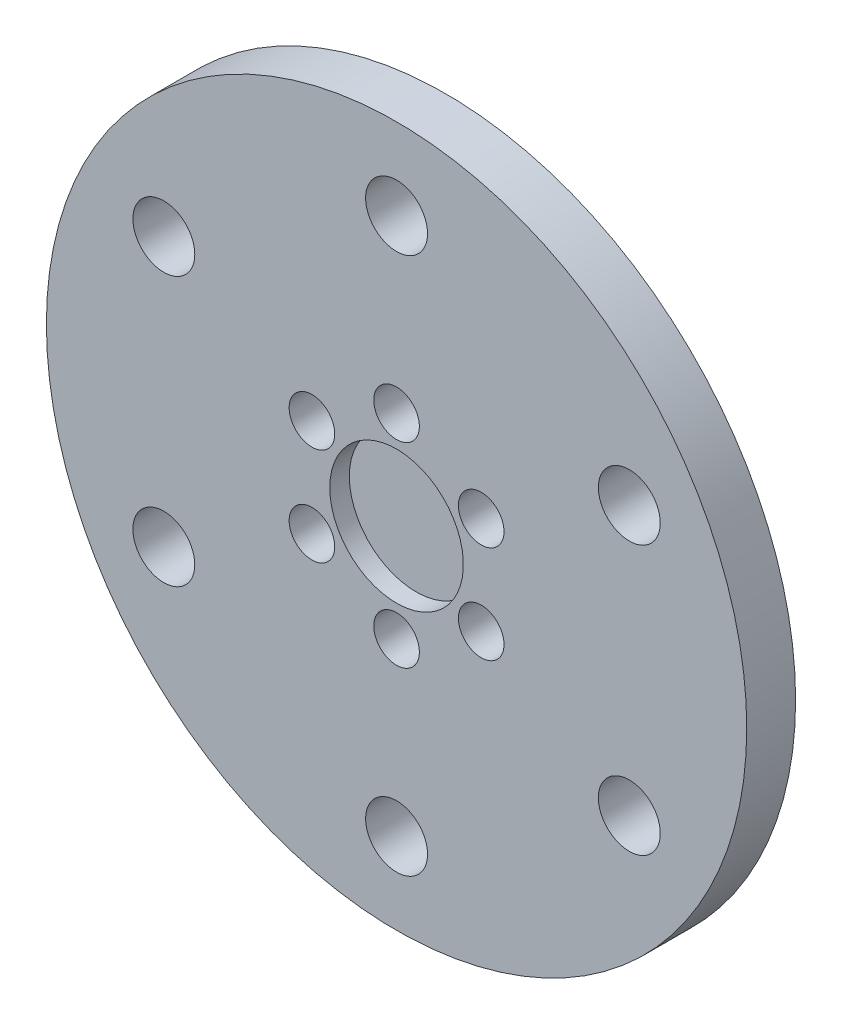
from build123d import *

# Parameters (mm, degrees)
SKETCH_1_R               = 21.5
EXTRUDE_1_DEPTH          = 3
CUT_EXTRUDE_1_DEPTH      = 31.553232235
CUT_EXTRUDE_1_DEPTH_BACK = 31.553232235
SKETCH_2_R               = 1.4
CUT_EXTRUDE_2_DEPTH      = 31.553232235
CUT_EXTRUDE_2_DEPTH_BACK = 31.553232235
SKETCH_3_R               = 1.9
CUT_EXTRUDE_3_DEPTH      = 31.553232235
CUT_EXTRUDE_3_DEPTH_BACK = 1.2
SKETCH_4_R               = 4.1


with BuildPart() as part:
    # ｽｹｯﾁ1 → ﾎﾞｽ - 押し出し1 (new body)
    with BuildSketch(Plane.XY):
        Circle(SKETCH_1_R)
    extrude(amount=EXTRUDE_1_DEPTH)

    # ｽｹｯﾁ2 → ｶｯﾄ - 押し出し1 (cut, two sides: drawn at the far end of the back side and taken through both)
    with BuildSketch(Plane.XY.offset(-CUT_EXTRUDE_1_DEPTH_BACK)):
        with Locations((0, 6)):
            Circle(SKETCH_2_R)
        with Locations((5.196152423, 3)):
            Circle(SKETCH_2_R)
        with Locations((5.196152423, -3)):
            Circle(SKETCH_2_R)
        with Locations((0, -6)):
            Circle(SKETCH_2_R)
        with Locations((-5.196152423, -3)):
            Circle(SKETCH_2_R)
        with Locations((-5.196152423, 3)):
            Circle(SKETCH_2_R)
    extrude(amount=CUT_EXTRUDE_1_DEPTH + CUT_EXTRUDE_1_DEPTH_BACK, mode=Mode.SUBTRACT)

    # ｽｹｯﾁ3 → ｶｯﾄ - 押し出し2 (cut, two sides: drawn at the far end of the back side and taken through both)
    with BuildSketch(Plane.XY.offset(3).offset(-CUT_EXTRUDE_2_DEPTH_BACK)):
        with Locations((0, 16.5)):
            Circle(SKETCH_3_R)
        with Locations((14.289419162, 8.25)):
            Circle(SKETCH_3_R)
        with Locations((14.289419162, -8.25)):
            Circle(SKETCH_3_R)
        with Locations((0, -16.5)):
            Circle(SKETCH_3_R)
        with Locations((-14.289419162, -8.25)):
            Circle(SKETCH_3_R)
        with Locations((-14.289419162, 8.25)):
            Circle(SKETCH_3_R)
    extrude(amount=CUT_EXTRUDE_2_DEPTH + CUT_EXTRUDE_2_DEPTH_BACK, mode=Mode.SUBTRACT)

    # ｽｹｯﾁ4 → ｶｯﾄ - 押し出し3 (cut, two sides: drawn at the far end of the back side and taken through both)
    with BuildSketch(Plane.XY.offset(3).offset(-CUT_EXTRUDE_3_DEPTH_BACK)):
        with Locations(Location((0, 0, 0), (0, 0, 180))):
            Circle(SKETCH_4_R)
    extrude(amount=CUT_EXTRUDE_3_DEPTH + CUT_EXTRUDE_3_DEPTH_BACK, mode=Mode.SUBTRACT)


solid = part.part
